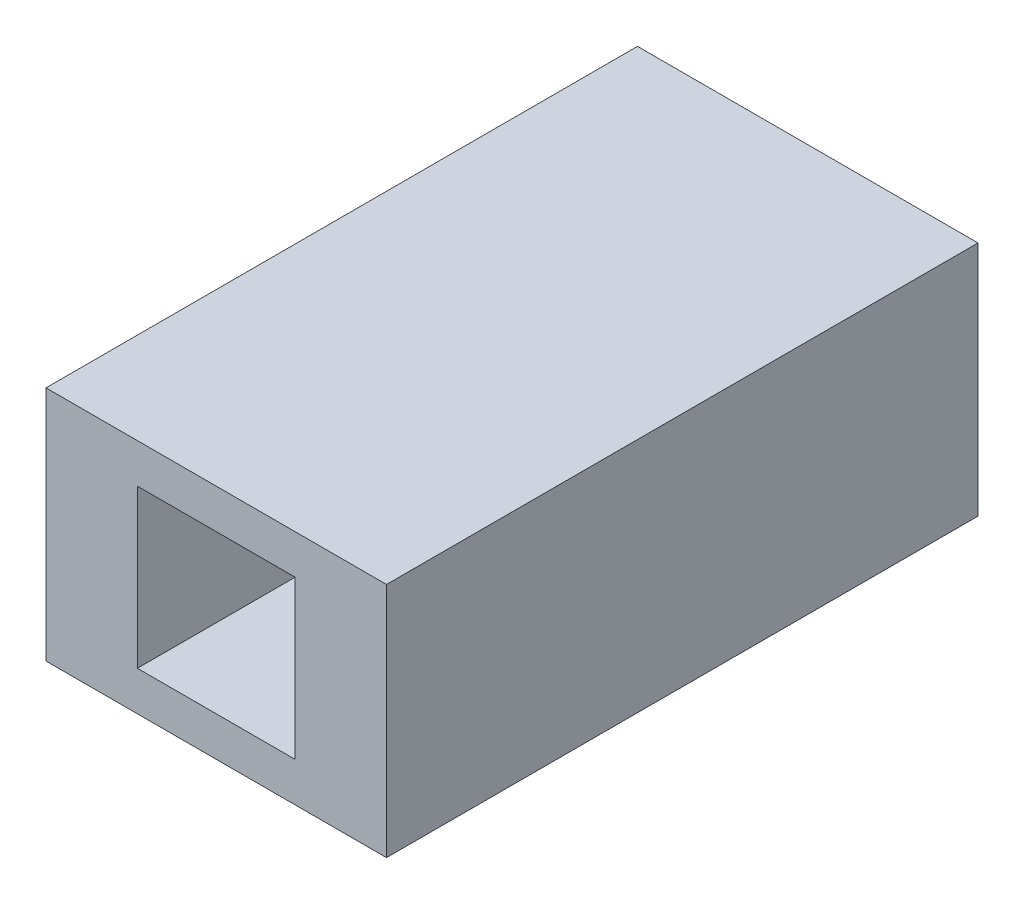
from build123d import *

# Parameters (mm, degrees)
SKETCH1_W           = 86.35
SKETCH1_H           = 60
BOSS_EXTRUDE1_DEPTH = 150
SKETCH2_W           = 40
SKETCH2_H           = 40
CUT_EXTRUDE1_DEPTH  = 145


with BuildPart() as part:
    # Sketch1 → Boss-Extrude1 (new body)
    with BuildSketch(Plane.XY):
        Rectangle(SKETCH1_W, SKETCH1_H)
    extrude(amount=BOSS_EXTRUDE1_DEPTH)

    # Sketch2 → Cut-Extrude1 (cut)
    with BuildSketch(Plane(origin=(0, 0, 150), x_dir=(-1, 0, 0), z_dir=(0, 0, -1))):
        Rectangle(SKETCH2_W, SKETCH2_H)
    extrude(amount=CUT_EXTRUDE1_DEPTH, mode=Mode.SUBTRACT)


solid = part.part
